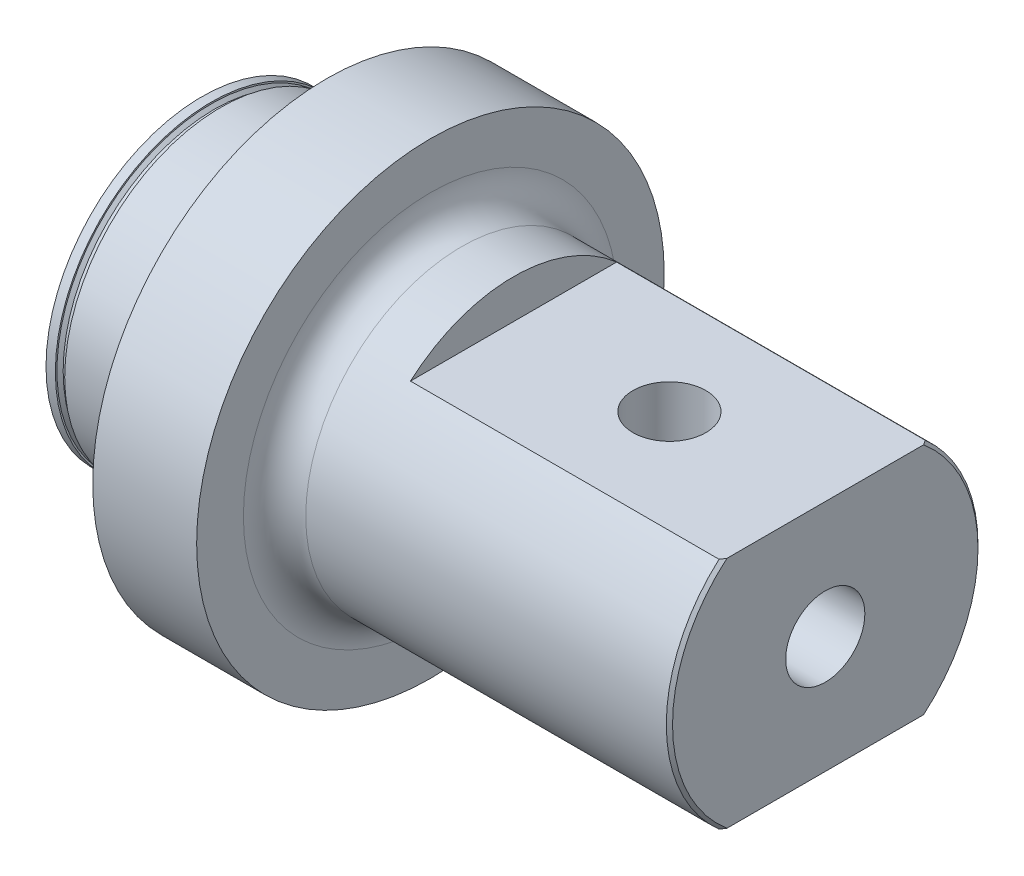
from build123d import *

# Parameters (mm, degrees)
CUT_EXTRUDE1_START     = -100
CUT_EXTRUDE1_DEPTH     = 100
F_1_12_TAPPED_HOLE1_D  = 23.41626
F_1_1_DIAMETER_HOLE1_D = 25.4
CHAMFER1_SIZE          = 1


with BuildPart() as part:
    # Sketch2 one side → Revolve1 (revolve)
    with BuildSketch(Plane.XY, mode=Mode.PRIVATE) as revolve1_sk:
        with BuildLine():
            Line((-94, 50), (-94, 48.5))
            Line((-94, 48.5), (-97, 48.5))
            Line((-97, 48.5), (-97, 50))
            Line((-97, 50), (-100, 50))
            Line((-100, 50), (-100, 0))
            Line((-100, 0), (100, 0))
            Line((100, 0), (100, 50))
            Line((100, 50), (-16.67, 50))
            ThreePointArc((-16.67, 50), (-23.741067812, 52.928932188), (-26.67, 60))
            Line((-26.67, 60), (-26.67, 75))
            Line((-26.67, 75), (-60, 75))
            Line((-60, 75), (-60, 50))
            Line((-60, 50), (-94, 50))
        make_face()
    revolve(revolve1_sk.sketch.rotate(Axis((-100, 0, 0), (1, 0, 0)), 90), axis=Axis((-100, 0, 0), (1, 0, 0)))

    # Sketch3 → Cut-Extrude1 (cut)
    with BuildSketch(Plane(origin=(100, 0, 0), x_dir=(0, 0, -1), z_dir=(1, 0, 0)).offset(CUT_EXTRUDE1_START)):
        with BuildLine():
            ThreePointArc((33.071891388, 37.5), (0, 50), (-33.071891388, 37.5))
            Line((-33.071891388, 37.5), (33.071891388, 37.5))
        make_face()
        with BuildLine():
            Line((33.071891388, -37.5), (-33.071891388, -37.5))
            ThreePointArc((-33.071891388, -37.5), (0, -50), (33.071891388, -37.5))
        make_face()
    extrude(amount=CUT_EXTRUDE1_DEPTH, mode=Mode.SUBTRACT)

    # 1-12 Tapped Hole1 (through all)
    with Locations(Plane(origin=(0, 37.5, 0), x_dir=(1, 0, 0), z_dir=(0, 1, 0))):
        with Locations((50, 0)):
            Hole(F_1_12_TAPPED_HOLE1_D / 2)

    # 1 (1) Diameter Hole1 (through all)
    with Locations(Plane(origin=(100, 0, 0), x_dir=(0, 0, -1), z_dir=(1, 0, 0))):
        with Locations((0, 0)):
            Hole(F_1_1_DIAMETER_HOLE1_D / 2)

    # Chamfer1
    chamfer1_edges = [part.edges().sort_by_distance(p)[0] for p in [
        (-97, 0, -48.5),
        (100, 0, -50),
        (100, 20.571891388, 45.571891388),
    ]]
    chamfer(chamfer1_edges, length=CHAMFER1_SIZE)


solid = part.part
